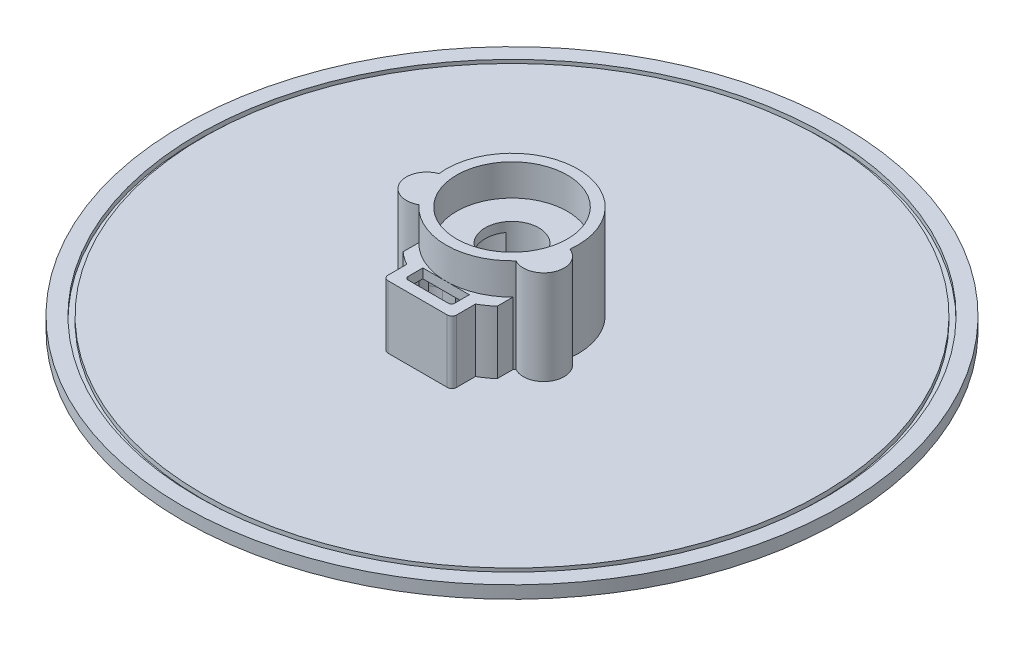
from build123d import *

# Parameters (mm, degrees)
SKETCH1_R               = 105
BOSS_EXTRUDE1_DEPTH     = 4
SKETCH4_R               = 8.55
BOSS_EXTRUDE3_DEPTH     = 20
SKETCH5_R               = 17.65
BOSS_EXTRUDE4_DEPTH     = 10
CUT_EXTRUDE2_DEPTH      = 17
CUT_EXTRUDE2_DEPTH_BACK = 152.492574075
SKETCH14_R              = 100.05
SKETCH14_R_2            = 98.45
CUT_EXTRUDE3_DEPTH      = 1.5
SKETCH15_R              = 0.85
CUT_EXTRUDE4_DEPTH      = 8


with BuildPart() as part:
    # Sketch1 → Boss-Extrude1 (new body)
    with BuildSketch(Plane(origin=(0, 0, 0), x_dir=(1, 0, 0), z_dir=(0, 1, 0))):
        with Locations(Location((0, 0, 0), (0, 0, 270))):
            Circle(SKETCH1_R)
    extrude(amount=BOSS_EXTRUDE1_DEPTH)


with BuildPart() as body_2:
    # Sketch4 → Boss-Extrude3 (new body)
    with BuildSketch(Plane(origin=(0, 4, 0), x_dir=(1, 0, 0), z_dir=(0, 1, 0))):
        with BuildLine():
            Line((15, -19.696938457), (15, -14.696938457))
            ThreePointArc((15, -14.696938457), (15.238514929, -14.449486592), (15.472948223, -14.198164434))
            ThreePointArc((15.472948223, -14.198164434), (24.543834091, -11.220038442), (20.861060766, -2.411668247))
            ThreePointArc((20.861060766, -2.411668247), (0, 21), (-20.861060766, -2.411668247))
            ThreePointArc((-20.861060766, -2.411668247), (-24.543834091, -11.220038442), (-15.472948223, -14.198164434))
            ThreePointArc((-15.472948223, -14.198164434), (-15.238514929, -14.449486592), (-15, -14.696938457))
            Line((-15, -14.696938457), (-15, -19.696938457))
            ThreePointArc((-15, -19.696938457), (-13.054950812, -21.25177335), (-10.95, -22.582152982))
            Line((-10.95, -22.582152982), (-10.95, -28.582152982))
            ThreePointArc((-10.95, -28.582152982), (-10.510660172, -29.642813154), (-9.45, -30.082152982))
            Line((-9.45, -30.082152982), (9.45, -30.082152982))
            ThreePointArc((9.45, -30.082152982), (10.510660172, -29.642813154), (10.95, -28.582152982))
            Line((10.95, -28.582152982), (10.95, -22.582152982))
            ThreePointArc((10.95, -22.582152982), (13.054950812, -21.25177335), (15, -19.696938457))
        make_face()
        with Locations(Location((0, 0, 0), (0, 0, 270))):
            Circle(SKETCH4_R, mode=Mode.SUBTRACT)
        with BuildLine():
            Line((7.4022, -25.690036345), (7.4022, -21.004036345))
            Line((7.4022, -21.004036345), (-7.4022, -21.004036345))
            Line((-7.4022, -21.004036345), (-7.4022, -25.690036345))
            ThreePointArc((-7.4022, -25.690036345), (-7.105206276, -26.407042621), (-6.3882, -26.704036345))
            Line((-6.3882, -26.704036345), (6.3882, -26.704036345))
            ThreePointArc((6.3882, -26.704036345), (7.105206276, -26.407042621), (7.4022, -25.690036345))
        make_face(mode=Mode.SUBTRACT)
    extrude(amount=BOSS_EXTRUDE3_DEPTH)

    # Sketch5 → Boss-Extrude4 (add)
    with BuildSketch(Plane(origin=(0, 24, 0), x_dir=(1, 0, 0), z_dir=(0, 1, 0))):
        with BuildLine():
            ThreePointArc((-15.472948223, -14.198164434), (0, -21), (15.472948223, -14.198164434))
            ThreePointArc((15.472948223, -14.198164434), (24.543834091, -11.220038442), (20.861060766, -2.411668247))
            ThreePointArc((20.861060766, -2.411668247), (0, 21), (-20.861060766, -2.411668247))
            ThreePointArc((-20.861060766, -2.411668247), (-24.543834091, -11.220038442), (-15.472948223, -14.198164434))
        make_face()
        with Locations(Location((0, 0, 0), (0, 0, 270))):
            Circle(SKETCH5_R, mode=Mode.SUBTRACT)
    extrude(amount=BOSS_EXTRUDE4_DEPTH)


with BuildPart() as cut_extrude2_tool:
    # Sketch2 → Cut-Extrude2 (new, two sides: drawn at the far end of the back side and taken through both)
    with BuildSketch(Plane(origin=(0, 4, 0), x_dir=(1, 0, 0), z_dir=(0, 1, 0)).offset(-CUT_EXTRUDE2_DEPTH_BACK)):
        with BuildLine():
            Line((10.647, -20.421307878), (10.647, -18.949486917))
            ThreePointArc((10.647, -18.949486917), (12.980207439, -15.845429725), (14.43247879, -12.24405))
            Line((14.43247879, -12.24405), (18.63225, -12.24405))
            ThreePointArc((18.63225, -12.24405), (22.691207439, -7.913921777), (18.361079216, -3.854964338))
            Line((18.361079216, -3.854964338), (14.120149763, -3.886165663))
            ThreePointArc((14.120149763, -3.886165663), (0, 6.72588), (-14.120149763, -3.886165663))
            Line((-14.120149763, -3.886165663), (-18.361079216, -3.854964338))
            ThreePointArc((-18.361079216, -3.854964338), (-22.691207439, -7.913921777), (-18.63225, -12.24405))
            Line((-18.63225, -12.24405), (-14.43247879, -12.24405))
            ThreePointArc((-14.43247879, -12.24405), (-12.980207439, -15.845429725), (-10.647, -18.949486917))
            Line((-10.647, -18.949486917), (-10.647, -20.421307878))
            Line((-10.647, -20.421307878), (-7.77231, -26.974538162))
            ThreePointArc((-7.77231, -26.974538162), (-7.46046659, -27.727394752), (-6.70761, -28.039238162))
            Line((-6.70761, -28.039238162), (6.70761, -28.039238162))
            ThreePointArc((6.70761, -28.039238162), (7.46046659, -27.727394752), (7.77231, -26.974538162))
            Line((7.77231, -26.974538162), (10.647, -20.421307878))
        make_face()
    extrude(amount=CUT_EXTRUDE2_DEPTH + CUT_EXTRUDE2_DEPTH_BACK)


with BuildPart() as part_1:
    add(part.part)

    # Cut-Extrude2: cut by cut_extrude2_tool
    add(cut_extrude2_tool.part, mode=Mode.SUBTRACT)

    # Sketch14 → Cut-Extrude3 (cut)
    with BuildSketch(Plane(origin=(0, 4, 0), x_dir=(1, 0, 0), z_dir=(0, 1, 0))):
        with Locations(Location((0, 0, 0), (0, 0, 270))):
            Circle(SKETCH14_R)
        with Locations(Location((0, 0, 0), (0, 0, 270))):
            Circle(SKETCH14_R_2, mode=Mode.SUBTRACT)
    extrude(amount=-CUT_EXTRUDE3_DEPTH, mode=Mode.SUBTRACT)


with BuildPart() as body_2_1:
    add(body_2.part)

    # Cut-Extrude2: cut by cut_extrude2_tool
    add(cut_extrude2_tool.part, mode=Mode.SUBTRACT)

    # Sketch15 → Cut-Extrude4 (cut)
    with BuildSketch(Plane.XZ.offset(-21)):
        with Locations(Location((-17.5, 8, 0), (0, 0, 270))):
            Circle(SKETCH15_R)
        with Locations(Location((17.5, 8, 0), (0, 0, 270))):
            Circle(SKETCH15_R)
    extrude(amount=-CUT_EXTRUDE4_DEPTH, mode=Mode.SUBTRACT)


solid = Compound([part_1.part, body_2_1.part])
